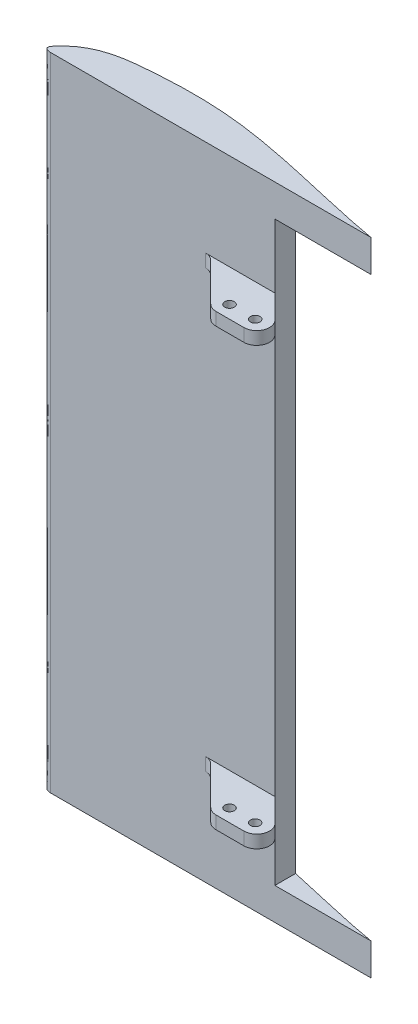
from build123d import *

# Parameters (mm, degrees)
BOSS_EXTRUDE1_DEPTH = 100
SKETCH2_W           = 15
SKETCH2_H           = 90
CUT_EXTRUDE3_DEPTH  = 100
SKETCH3_W           = 10
SKETCH3_H           = 2
BOSS_EXTRUDE2_DEPTH = 10
FILLET1_R           = 2
FILLET2_R           = 2
SKETCH5_R           = 0.75
CUT_EXTRUDE4_DEPTH  = 110


with BuildPart() as part:
    # Sketch1 → Boss-Extrude1 (new body)
    with BuildSketch(Plane(origin=(0, 0, 0), x_dir=(1, 0, 0), z_dir=(0, 1, 0))):
        with BuildLine():
            Line((-23.835160585, 0), (26.164839415, 0))
            add(Edge.make_bspline(
                [(-24.267578895, 1.256220546), (-22.278212262, 3.553586128), (-18.738393104, 4.793268312), (-8.850120496, 5.774851838), (4.13271293, 5.525012752), (19.211918986, 1.162580188), (26.164839415, 0)],
                knots=[0.021997225, 0.021997225, 0.021997225, 0.021997225, 0.155271246, 0.206186057, 0.531145331, 1, 1, 1, 1], degree=3))
            add(Edge.make_bspline(
                [(-24.267578895, 1.256220546), (-25.367081291, 0.124338635), (-23.835160585, 0)],
                knots=[0, 0, 0, 1, 1, 1], degree=2))
        make_face()
    extrude(amount=BOSS_EXTRUDE1_DEPTH)

    # Sketch2 → Cut-Extrude3 (cut)
    with BuildSketch(Plane.XY.offset(10)):
        with Locations((18.664839415, 50)):
            Rectangle(SKETCH2_W, SKETCH2_H)
    extrude(amount=-CUT_EXTRUDE3_DEPTH, mode=Mode.SUBTRACT)

    # Sketch3 → Boss-Extrude2 (add, along a direction that is not the sketch's normal)
    with BuildSketch(Plane.XY):
        with Locations((6.164839415, 84)):
            Rectangle(SKETCH3_W, SKETCH3_H)
        with Locations((6.164839415, 16)):
            Rectangle(SKETCH3_W, SKETCH3_H)
    extrude(amount=BOSS_EXTRUDE2_DEPTH, dir=(0.7071067811865511, 0, 0.7071067811865439))

    # Fillet1
    fillet1_edges = [part.edges().sort_by_distance(p)[0] for p in [
        (18.235907227, 84, 7.071067812),
        (8.235907227, 84, 7.071067812),
        (8.235907227, 16, 7.071067812),
        (18.235907227, 16, 7.071067812),
    ]]
    fillet(fillet1_edges, radius=FILLET1_R)

    # Fillet2
    fillet2_edges = [part.edges().sort_by_distance(p)[0] for p in [
        (1.164839415, 84, 0),
        (1.164839415, 16, 0),
    ]]
    fillet(fillet2_edges, radius=FILLET2_R)

    # Sketch5 → Cut-Extrude4 (cut)
    with BuildSketch(Plane(origin=(0, 85, 0), x_dir=(1, 0, 0), z_dir=(0, 1, 0))):
        with Locations(Location((9.164839415, -5.071067812, 0), (0, 0, 90))):
            Circle(SKETCH5_R)
        with Locations(Location((13.164839415, -5.071067812, 0), (0, 0, 90))):
            Circle(SKETCH5_R)
    extrude(amount=-CUT_EXTRUDE4_DEPTH, mode=Mode.SUBTRACT)


solid = part.part
